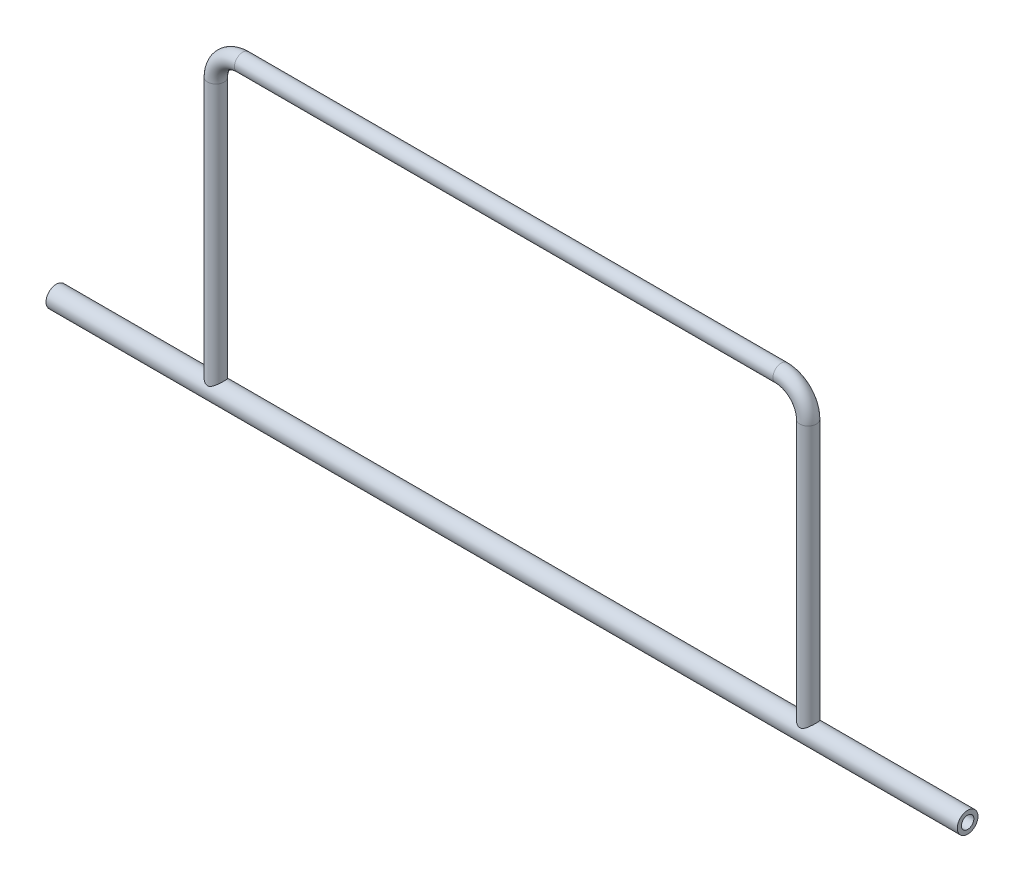
from build123d import *

# Parameters (mm, degrees)
SKETCH1_R           = 5
BOSS_EXTRUDE1_DEPTH = 220
SWEEP1_PROFILE_R    = 4
SKETCH9_R           = 3
CUT_EXTRUDE1_DEPTH  = 220


with BuildPart() as part:
    # Sketch1 → Boss-Extrude1 (new body)
    with BuildSketch(Plane(origin=(0, 0, 0), x_dir=(0, 0, -1), z_dir=(1, 0, 0))):
        Circle(SKETCH1_R)
    boss_extrude1 = extrude(amount=-BOSS_EXTRUDE1_DEPTH)

    # Sweep1: sweep along a path in Sketch2
    with BuildLine(Plane.XY) as sweep1_path:
        Line((-143, 0), (-143, 130))
        ThreePointArc((-143, 130), (-139.192388155, 139.192388155), (-130, 143))
        Line((-130, 143), (0, 143))
    # Sweep1 profile (on start of the path) → Sweep1 (sweep)
    with BuildSketch(Plane(origin=(-143, 0, 0), x_dir=(0, 0, 1), z_dir=(0, 1, 0))):
        Circle(SWEEP1_PROFILE_R)
    sweep1 = sweep(path=sweep1_path.line)

    # Sketch9 → Cut-Extrude1 (cut)
    with BuildSketch(Plane(origin=(0, 0, 0), x_dir=(0, 0, -1), z_dir=(1, 0, 0))):
        Circle(SKETCH9_R)
    cut_extrude1 = extrude(amount=-CUT_EXTRUDE1_DEPTH, mode=Mode.SUBTRACT)

    # Mirror1: Boss-Extrude1, Sweep1, Cut-Extrude1 across plane
    add(boss_extrude1.mirror(Plane(origin=(0, 0, 0), x_dir=(0, 0, 1), z_dir=(1, 0, 0))))
    add(sweep1.mirror(Plane(origin=(0, 0, 0), x_dir=(0, 0, 1), z_dir=(1, 0, 0))))
    add(cut_extrude1.mirror(Plane(origin=(0, 0, 0), x_dir=(0, 0, 1), z_dir=(1, 0, 0))), mode=Mode.SUBTRACT)


solid = part.part
